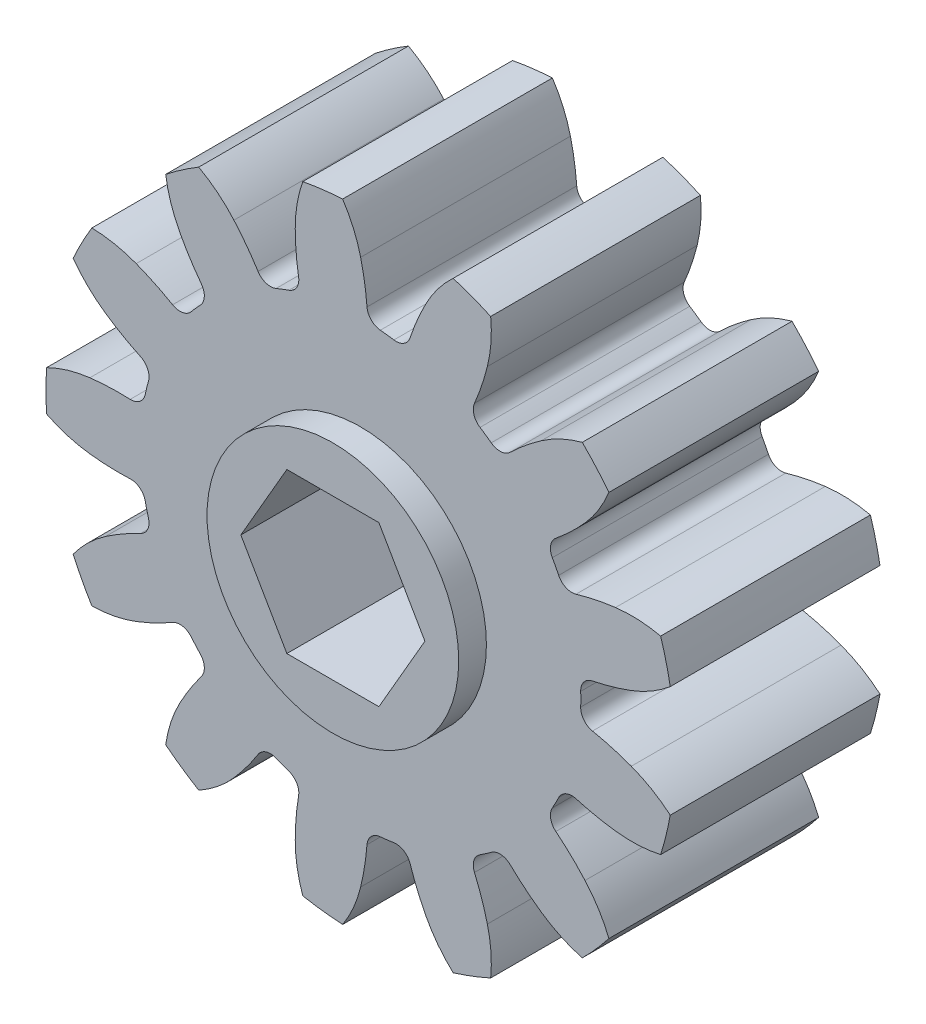
from build123d import *

# Parameters (mm, degrees)
SKETCH1_R           = 9.525
ROUND_STOCK_DEPTH   = 3.175
SINGLE_TOOTH_DEPTH  = 15.892070037
TOOTH_PATTERN_COUNT = 13
CUT_EXTRUDE1_DEPTH  = 15.882187212
SKETCH8_R           = 3.81
BOSS_EXTRUDE1_DEPTH = 0.8382


with BuildPart() as part:
    # Sketch1 → Round Stock (new, symmetric)
    with BuildSketch(Plane.XY):
        Circle(SKETCH1_R)
    extrude(amount=ROUND_STOCK_DEPTH, both=True)

    # Sketch2 → Single Tooth (cut, through all)
    with BuildSketch(Plane.XY.offset(3.175)):
        with BuildLine():
            ThreePointArc((-8.699219347, -3.879330837), (-9.248220811, -2.279481702), (-9.505591122, -0.607751944))
            ThreePointArc((-9.505591122, -0.607751944), (-8.866874127, -0.859264513), (-8.194501154, -0.997585))
            ThreePointArc((-8.194501154, -0.997585), (-7.585039492, -1.044554082), (-6.973773022, -1.042846396))
            ThreePointArc((-6.973773022, -1.042846396), (-6.682727126, -1.135452938), (-6.520145475, -1.394008333))
            ThreePointArc((-6.520145475, -1.394008333), (-6.473754568, -1.595637192), (-6.421130074, -1.795729609))
            ThreePointArc((-6.421130074, -1.795729609), (-6.444932293, -2.100224502), (-6.659604229, -2.317479295))
            ThreePointArc((-6.659604229, -2.317479295), (-7.201647409, -2.600036906), (-7.71947129, -2.92485692))
            ThreePointArc((-7.71947129, -2.92485692), (-8.250547255, -3.35980093), (-8.699219347, -3.879330837))
        make_face()
    single_tooth = extrude(amount=-SINGLE_TOOTH_DEPTH, mode=Mode.SUBTRACT)

    # Tooth Pattern: Single Tooth ×13 about axis
    tooth_pattern_axis = Axis((0, 0, 50), (0, 0, -1))
    for i in range(1, TOOTH_PATTERN_COUNT):
        add(single_tooth.rotate(tooth_pattern_axis, i * 360 / TOOTH_PATTERN_COUNT), mode=Mode.SUBTRACT)

    # Sketch7 → Cut-Extrude1 (cut, through all)
    with BuildSketch(Plane(origin=(0, 0, -3.175), x_dir=(-1, 0, 0), z_dir=(0, 0, -1))):
        Polygon((1.3931462, -2.413), (2.786292399, 0), (1.3931462, 2.413), (-1.3931462, 2.413), (-2.786292399, 0), (-1.3931462, -2.413), align=None)
    extrude(amount=-CUT_EXTRUDE1_DEPTH, mode=Mode.SUBTRACT)

    # Sketch8 → Boss-Extrude1 (add)
    with BuildSketch(Plane.XY.offset(3.175)):
        Circle(SKETCH8_R)
        Polygon((-1.3931462, -2.413), (1.3931462, -2.413), (2.786292399, 0), (1.3931462, 2.413), (-1.3931462, 2.413), (-2.786292399, 0), align=None, mode=Mode.SUBTRACT)
    extrude(amount=BOSS_EXTRUDE1_DEPTH)


solid = part.part
